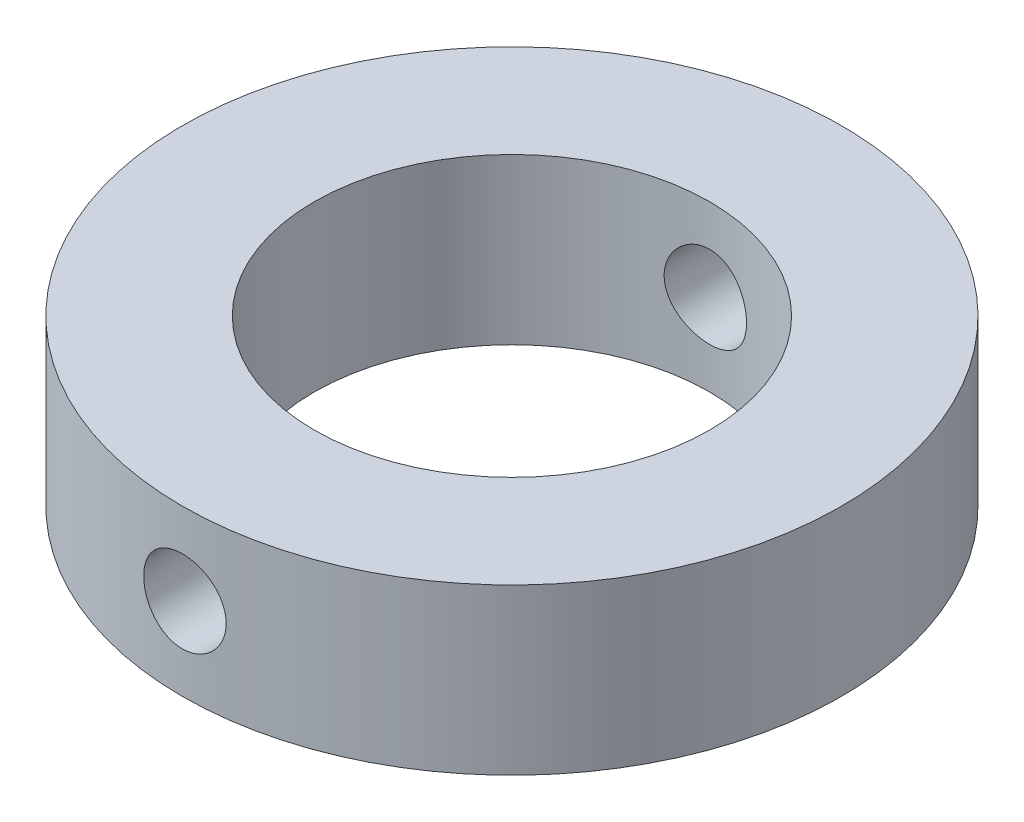
from build123d import *

# Parameters (mm, degrees)
SKETCH1_R               = 10
SKETCH1_R_2             = 6
BOSS_EXTRUDE1_DEPTH     = 5
CUT_EXTRUDE1_DEPTH      = 16
CUT_EXTRUDE1_DEPTH_BACK = 16
SKETCH2_R               = 1.25


with BuildPart() as part:
    # Sketch1 → Boss-Extrude1 (new body)
    with BuildSketch(Plane(origin=(0, 0, 0), x_dir=(1, 0, 0), z_dir=(0, 1, 0))):
        with Locations(Location((0, 0, 0), (0, 0, 270))):
            Circle(SKETCH1_R)
        with Locations(Location((0, 0, 0), (0, 0, 270))):
            Circle(SKETCH1_R_2, mode=Mode.SUBTRACT)
    extrude(amount=BOSS_EXTRUDE1_DEPTH)

    # Sketch2 → Cut-Extrude1 (cut, two sides: drawn at the far end of the back side and taken through both)
    with BuildSketch(Plane.XY.offset(-CUT_EXTRUDE1_DEPTH_BACK)):
        with Locations((0, 2.5)):
            Circle(SKETCH2_R)
    extrude(amount=CUT_EXTRUDE1_DEPTH + CUT_EXTRUDE1_DEPTH_BACK, mode=Mode.SUBTRACT)


solid = part.part
